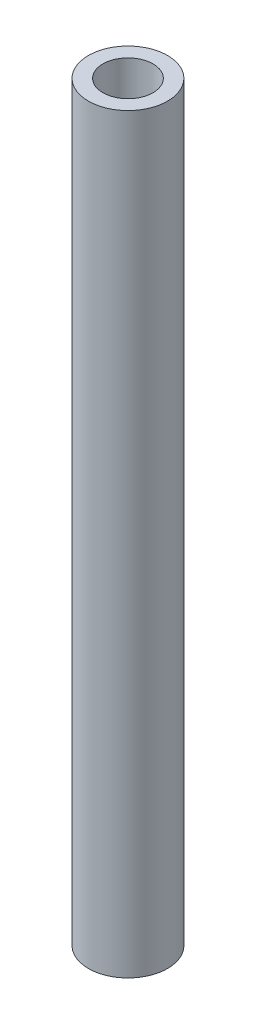
from build123d import *

# Parameters (mm, degrees)
SKETCH1_R           = 3.16
SKETCH1_R_2         = 2
BOSS_EXTRUDE1_DEPTH = 60


with BuildPart() as part:
    # Sketch1 → Boss-Extrude1 (new body)
    with BuildSketch(Plane(origin=(0, 0, 0), x_dir=(1, 0, 0), z_dir=(0, 1, 0))):
        with Locations(Location((0, 0, 0), (0, 0, 270))):
            Circle(SKETCH1_R)
        with Locations(Location((0, 0, 0), (0, 0, 270))):
            Circle(SKETCH1_R_2, mode=Mode.SUBTRACT)
    extrude(amount=BOSS_EXTRUDE1_DEPTH)


solid = part.part
